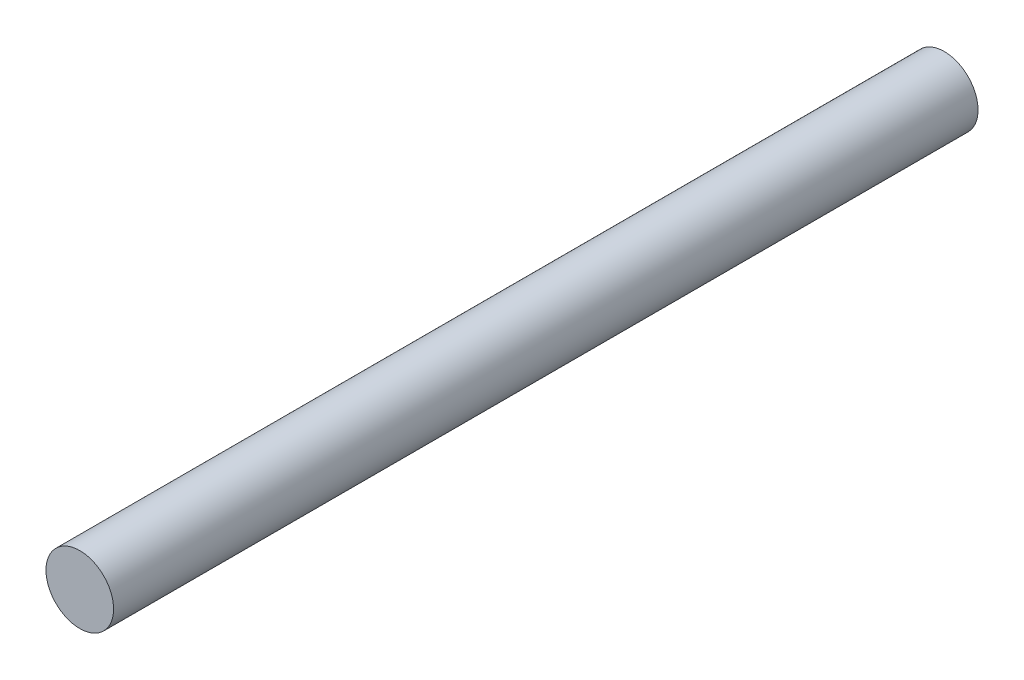
from build123d import *

# Parameters (mm, degrees)
SKETCH1_R           = 47.6631
BOSS_EXTRUDE1_DEPTH = 1219.2


with BuildPart() as part:
    # Sketch1 → Boss-Extrude1 (new body)
    with BuildSketch(Plane.XY):
        with Locations(Location((0, 0, 0), (0, 0, 180))):
            Circle(SKETCH1_R)
    extrude(amount=BOSS_EXTRUDE1_DEPTH)


solid = part.part
